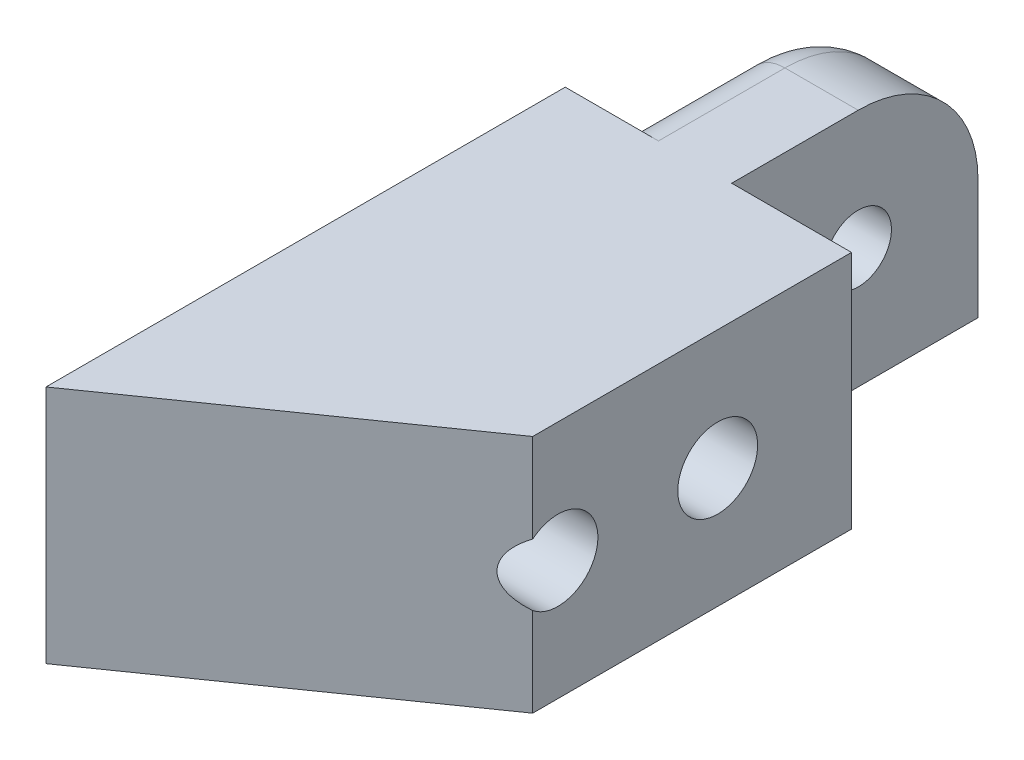
from build123d import *

# Parameters (mm, degrees)
BOSS_EXTRUDE1_DEPTH = 18
SKETCH3_R           = 2.5
SKETCH3_R_2         = 3
CUT_EXTRUDE1_DEPTH  = 42.41062241
FILLET1_R           = 3


with BuildPart() as part:
    # Sketch1 → Boss-Extrude1 (new body)
    with BuildSketch(Plane(origin=(0, 0, 0), x_dir=(1, 0, 0), z_dir=(0, 1, 0))):
        Polygon((-8.25, 11.972768964), (-8.25, -27.027231036), (13.25, -11.972768964), (13.25, 11.972768964), (4.25, 11.972768964), (4.25, 30.472768964), (-4.25, 30.472768964), (-4.25, 11.972768964), align=None)
    extrude(amount=BOSS_EXTRUDE1_DEPTH)

    # Sketch3 → Cut-Extrude1 (cut, through all)
    with BuildSketch(Plane.ZY.offset(8.25)):
        with Locations((-21.472768964, 9)):
            Circle(SKETCH3_R)
        with Locations((-1.922768964, 9)):
            Circle(SKETCH3_R_2)
        with Locations((10.077231036, 9)):
            Circle(SKETCH3_R_2)
        with BuildLine():
            Line((-30.472768964, 9), (-30.472768964, 18))
            Line((-30.472768964, 18), (-21.472768964, 18))
            ThreePointArc((-21.472768964, 18), (-27.836729995, 15.363961031), (-30.472768964, 9))
        make_face()
    extrude(amount=-CUT_EXTRUDE1_DEPTH, mode=Mode.SUBTRACT)

    # Fillet1
    fillet1_edges = [part.edges().sort_by_distance(p)[0] for p in [
        (-4.25, 18, -16.722768964),
        (-4.25, 4.5, -30.472768964),
        (-4.25, 15.363961031, -27.836729995),
    ]]
    fillet(fillet1_edges, radius=FILLET1_R)


solid = part.part
